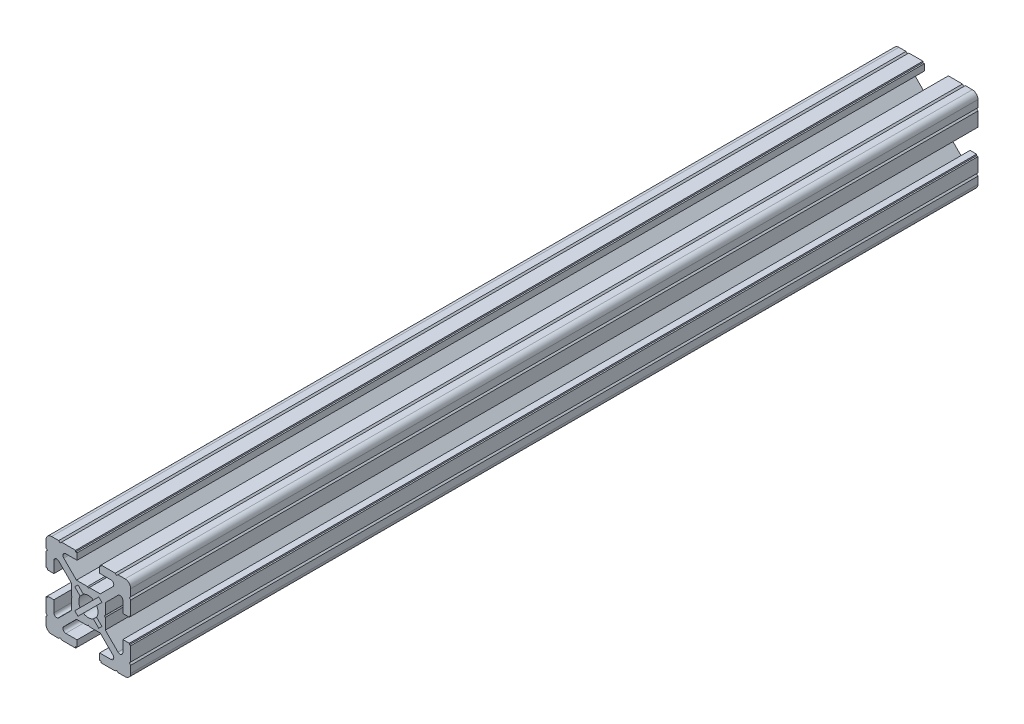
from build123d import *

# Parameters (mm, degrees)
BOSS_EXTRUDE1_DEPTH = 300


with BuildPart() as part:
    # Sketch1 → Boss-Extrude1 (new body)
    with BuildSketch(Plane.XY):
        with BuildLine():
            Line((12.999999999, 14.999999999), (10.499999999, 14.999999999))
            Line((10.499999999, 14.999999999), (9.999999999, 14.499999999))
            Line((9.999999999, 14.499999999), (9.5, 14.999999999))
            Line((9.5, 14.999999999), (4.5, 14.999999999))
            Line((4.5, 14.999999999), (4.5, 14.5))
            Line((4.5, 14.5), (4, 14.5))
            Line((4, 14.5), (4, 12.200000005))
            Line((4, 12.200000005), (7.999999994, 12.200000005))
            ThreePointArc((7.999999994, 12.200000005), (8.923879532, 11.582683434), (8.707106779, 10.492893215))
            Line((8.707106779, 10.492893215), (4.214213564, 6))
            Line((4.214213564, 6), (0.312520901, 6))
            Line((0.312520901, 6), (0, 5.7))
            Line((0, 5.7), (-0.312520903, 6))
            Line((-0.312520903, 6), (-4.214213564, 6))
            Line((-4.214213564, 6), (-8.70710678, 10.492893215))
            ThreePointArc((-8.70710678, 10.492893215), (-8.923879532, 11.582683434), (-7.999999995, 12.200000005))
            Line((-7.999999995, 12.200000005), (-4, 12.200000005))
            Line((-4, 12.200000005), (-4, 14.5))
            Line((-4, 14.5), (-4.5, 14.5))
            Line((-4.5, 14.5), (-4.5, 14.999999999))
            Line((-4.5, 14.999999999), (-9.500000003, 14.999999999))
            Line((-9.500000003, 14.999999999), (-10.000000002, 14.499999999))
            Line((-10.000000002, 14.499999999), (-10.500000001, 14.999999999))
            Line((-10.500000001, 14.999999999), (-13, 14.999999999))
            ThreePointArc((-13, 14.999999999), (-14.414213562, 14.414213561), (-15, 12.999999999))
            Line((-15, 12.999999999), (-15, 10.5))
            Line((-15, 10.5), (-14.500000001, 10.000000001))
            Line((-14.500000001, 10.000000001), (-15, 9.500000001))
            Line((-15, 9.500000001), (-15, 4.5))
            Line((-15, 4.5), (-14.5, 4.5))
            Line((-14.5, 4.5), (-14.5, 4))
            Line((-14.5, 4), (-12.200000005, 4))
            Line((-12.200000005, 4), (-12.200000005, 7.999999994))
            ThreePointArc((-12.200000005, 7.999999994), (-11.582683434, 8.923879532), (-10.492893215, 8.707106779))
            Line((-10.492893215, 8.707106779), (-6, 4.214213564))
            Line((-6, 4.214213564), (-6, 0.312520901))
            Line((-6, 0.312520901), (-5.7, 0))
            Line((-5.7, 0), (-6, -0.312520903))
            Line((-6, -0.312520903), (-6, -4.214213564))
            Line((-6, -4.214213564), (-10.492893215, -8.70710678))
            ThreePointArc((-10.492893215, -8.70710678), (-11.582683434, -8.923879532), (-12.200000005, -7.999999995))
            Line((-12.200000005, -7.999999995), (-12.200000005, -4))
            Line((-12.200000005, -4), (-14.5, -4))
            Line((-14.5, -4), (-14.5, -4.5))
            Line((-14.5, -4.5), (-15, -4.5))
            Line((-15, -4.5), (-15, -9.500000001))
            Line((-15, -9.500000001), (-14.500000001, -10.000000001))
            Line((-14.500000001, -10.000000001), (-15, -10.5))
            Line((-15, -10.5), (-15, -13))
            ThreePointArc((-15, -13), (-14.414213562, -14.414213562), (-13, -15))
            Line((-13, -15), (-10.489897949, -15))
            Line((-10.489897949, -15), (-9.989897949, -14.5))
            Line((-9.989897949, -14.5), (-9.500000001, -15))
            Line((-9.500000001, -15), (-4.5, -15))
            Line((-4.5, -15), (-4.5, -14.5))
            Line((-4.5, -14.5), (-4, -14.5))
            Line((-4, -14.5), (-4, -12.200000005))
            Line((-4, -12.200000005), (-7.999999995, -12.200000005))
            ThreePointArc((-7.999999995, -12.200000005), (-8.923879532, -11.582683434), (-8.70710678, -10.492893215))
            Line((-8.70710678, -10.492893215), (-4.214213564, -6))
            Line((-4.214213564, -6), (-0.312520901, -6))
            Line((-0.312520901, -6), (0, -5.7))
            Line((0, -5.7), (0.312520903, -6))
            Line((0.312520903, -6), (4.214213564, -6))
            Line((4.214213564, -6), (8.70710678, -10.492893215))
            ThreePointArc((8.70710678, -10.492893215), (8.923879532, -11.582683434), (7.999999995, -12.200000005))
            Line((7.999999995, -12.200000005), (4, -12.200000005))
            Line((4, -12.200000005), (4, -14.5))
            Line((4, -14.5), (4.5, -14.5))
            Line((4.5, -14.5), (4.5, -15))
            Line((4.5, -15), (9.500000001, -15))
            Line((9.500000001, -15), (10.000000001, -14.500000001))
            Line((10.000000001, -14.500000001), (10.5, -15))
            Line((10.5, -15), (12.999999999, -15))
            ThreePointArc((12.999999999, -15), (14.414213561, -14.414213562), (14.999999999, -13))
            Line((14.999999999, -13), (14.999999999, -10.500000001))
            Line((14.999999999, -10.500000001), (14.499999999, -10.000000002))
            Line((14.499999999, -10.000000002), (14.999999999, -9.500000002))
            Line((14.999999999, -9.500000002), (14.999999999, -4.5))
            Line((14.999999999, -4.5), (14.5, -4.5))
            Line((14.5, -4.5), (14.5, -4))
            Line((14.5, -4), (12.200000005, -4))
            Line((12.200000005, -4), (12.200000005, -7.999999995))
            ThreePointArc((12.200000005, -7.999999995), (11.582683434, -8.923879532), (10.492893215, -8.70710678))
            Line((10.492893215, -8.70710678), (6, -4.214213564))
            Line((6, -4.214213564), (6, -0.312520901))
            Line((6, -0.312520901), (5.7, 0))
            Line((5.7, 0), (6, 0.312520903))
            Line((6, 0.312520903), (6, 4.214213564))
            Line((6, 4.214213564), (10.492893215, 8.70710678))
            ThreePointArc((10.492893215, 8.70710678), (11.582683434, 8.923879532), (12.200000005, 7.999999995))
            Line((12.200000005, 7.999999995), (12.200000005, 4))
            Line((12.200000005, 4), (14.5, 4))
            Line((14.5, 4), (14.5, 4.5))
            Line((14.5, 4.5), (14.999999999, 4.5))
            Line((14.999999999, 4.5), (14.999999999, 9.5))
            Line((14.999999999, 9.5), (14.499999999, 9.999999999))
            Line((14.499999999, 9.999999999), (14.999999999, 10.499999999))
            Line((14.999999999, 10.499999999), (14.999999999, 12.999999999))
            ThreePointArc((14.999999999, 12.999999999), (14.414213561, 14.414213561), (12.999999999, 14.999999999))
        make_face()
        with BuildLine():
            Line((-2.902349714, 1.770978864), (-4.808326112, 3.676955262))
            Line((-4.808326112, 3.676955262), (-3.676955262, 4.808326112))
            Line((-3.676955262, 4.808326112), (-1.770978864, 2.902349714))
            ThreePointArc((-1.770978864, 2.902349714), (0, 3.4), (1.770978864, 2.902349714))
            Line((1.770978864, 2.902349714), (3.676955262, 4.808326112))
            Line((3.676955262, 4.808326112), (4.808326112, 3.676955262))
            Line((4.808326112, 3.676955262), (2.902349714, 1.770978864))
            ThreePointArc((2.902349714, 1.770978864), (3.4, 0), (2.902349714, -1.770978864))
            Line((2.902349714, -1.770978864), (4.808326112, -3.676955262))
            Line((4.808326112, -3.676955262), (3.676955262, -4.808326112))
            Line((3.676955262, -4.808326112), (1.770978864, -2.902349714))
            ThreePointArc((1.770978864, -2.902349714), (0, -3.4), (-1.770978864, -2.902349714))
            Line((-1.770978864, -2.902349714), (-3.676955262, -4.808326112))
            Line((-3.676955262, -4.808326112), (-4.808326112, -3.676955262))
            Line((-4.808326112, -3.676955262), (-2.902349714, -1.770978864))
            ThreePointArc((-2.902349714, -1.770978864), (-3.4, 0), (-2.902349714, 1.770978864))
        make_face(mode=Mode.SUBTRACT)
    extrude(amount=BOSS_EXTRUDE1_DEPTH)


solid = part.part
